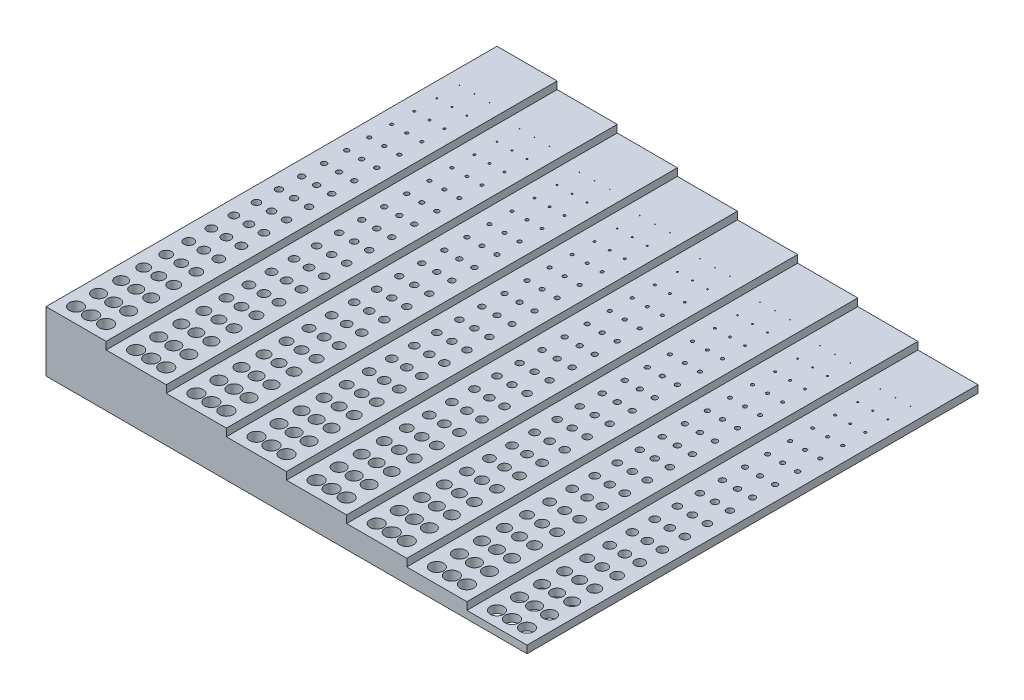
from build123d import *

# Parameters (mm, degrees)
BOSS_EXTRUDE1_DEPTH = 30
CUT_EXTRUDE1_REACH  = 46.045
SKETCH4_R           = 0.45
SKETCH4_R_2         = 0.425
SKETCH4_R_3         = 0.4
SKETCH4_R_4         = 0.375
SKETCH4_R_5         = 0.35
SKETCH4_R_6         = 0.325
SKETCH4_R_7         = 0.3
SKETCH4_R_8         = 0.275
SKETCH4_R_9         = 0.25
SKETCH4_R_10        = 0.225
SKETCH4_R_11        = 0.2
SKETCH4_R_12        = 0.175
SKETCH4_R_13        = 0.15
SKETCH4_R_14        = 0.125
SKETCH4_R_15        = 0.1
SKETCH4_R_16        = 0.075
SKETCH4_R_17        = 0.05
SKETCH4_R_18        = 0.025
LPATTERN1_COUNT     = 31
LPATTERN1_PITCH     = 1


with BuildPart() as part:
    # Sketch3 → Boss-Extrude1 (new body)
    with BuildSketch(Plane.XY):
        Polygon((0, 0), (0, 4), (4, 4), (4, 3.5), (8, 3.5), (8, 3), (12, 3), (12, 2.5), (16, 2.5), (16, 2), (20, 2), (20, 1.5), (24, 1.5), (24, 1), (28, 1), (28, 0.5), (32, 0.5), (32, 0), align=None)
    extrude(amount=BOSS_EXTRUDE1_DEPTH)

    # Sketch4 → Cut-Extrude1 (cut, up to next)
    with BuildSketch(Plane(origin=(0, 4, 0), x_dir=(1, 0, 0), z_dir=(0, 1, 0)), mode=Mode.PRIVATE) as cut_extrude1_sk1:
        with Locations(Location((1, -29, 0), (0, 0, 270))):
            Circle(SKETCH4_R)
    cut_extrude1_tool1 = extrude(cut_extrude1_sk1.sketch, amount=-CUT_EXTRUDE1_REACH, mode=Mode.PRIVATE) & part.part
    # Sketch4 → Cut-Extrude1 (cut, up to next)
    with BuildSketch(Plane(origin=(0, 4, 0), x_dir=(1, 0, 0), z_dir=(0, 1, 0)), mode=Mode.PRIVATE) as cut_extrude1_sk2:
        with Locations(Location((1, -27.5, 0), (0, 0, 270))):
            Circle(SKETCH4_R_2)
    cut_extrude1_tool2 = extrude(cut_extrude1_sk2.sketch, amount=-CUT_EXTRUDE1_REACH, mode=Mode.PRIVATE) & part.part
    # Sketch4 → Cut-Extrude1 (cut, up to next)
    with BuildSketch(Plane(origin=(0, 4, 0), x_dir=(1, 0, 0), z_dir=(0, 1, 0)), mode=Mode.PRIVATE) as cut_extrude1_sk3:
        with Locations(Location((1, -26, 0), (0, 0, 270))):
            Circle(SKETCH4_R_3)
    cut_extrude1_tool3 = extrude(cut_extrude1_sk3.sketch, amount=-CUT_EXTRUDE1_REACH, mode=Mode.PRIVATE) & part.part
    # Sketch4 → Cut-Extrude1 (cut, up to next)
    with BuildSketch(Plane(origin=(0, 4, 0), x_dir=(1, 0, 0), z_dir=(0, 1, 0)), mode=Mode.PRIVATE) as cut_extrude1_sk4:
        with Locations(Location((1, -24.5, 0), (0, 0, 270))):
            Circle(SKETCH4_R_4)
    cut_extrude1_tool4 = extrude(cut_extrude1_sk4.sketch, amount=-CUT_EXTRUDE1_REACH, mode=Mode.PRIVATE) & part.part
    # Sketch4 → Cut-Extrude1 (cut, up to next)
    with BuildSketch(Plane(origin=(0, 4, 0), x_dir=(1, 0, 0), z_dir=(0, 1, 0)), mode=Mode.PRIVATE) as cut_extrude1_sk5:
        with Locations(Location((1, -23, 0), (0, 0, 270))):
            Circle(SKETCH4_R_5)
    cut_extrude1_tool5 = extrude(cut_extrude1_sk5.sketch, amount=-CUT_EXTRUDE1_REACH, mode=Mode.PRIVATE) & part.part
    # Sketch4 → Cut-Extrude1 (cut, up to next)
    with BuildSketch(Plane(origin=(0, 4, 0), x_dir=(1, 0, 0), z_dir=(0, 1, 0)), mode=Mode.PRIVATE) as cut_extrude1_sk6:
        with Locations(Location((1, -21.5, 0), (0, 0, 270))):
            Circle(SKETCH4_R_6)
    cut_extrude1_tool6 = extrude(cut_extrude1_sk6.sketch, amount=-CUT_EXTRUDE1_REACH, mode=Mode.PRIVATE) & part.part
    # Sketch4 → Cut-Extrude1 (cut, up to next)
    with BuildSketch(Plane(origin=(0, 4, 0), x_dir=(1, 0, 0), z_dir=(0, 1, 0)), mode=Mode.PRIVATE) as cut_extrude1_sk7:
        with Locations(Location((1, -20, 0), (0, 0, 270))):
            Circle(SKETCH4_R_7)
    cut_extrude1_tool7 = extrude(cut_extrude1_sk7.sketch, amount=-CUT_EXTRUDE1_REACH, mode=Mode.PRIVATE) & part.part
    # Sketch4 → Cut-Extrude1 (cut, up to next)
    with BuildSketch(Plane(origin=(0, 4, 0), x_dir=(1, 0, 0), z_dir=(0, 1, 0)), mode=Mode.PRIVATE) as cut_extrude1_sk8:
        with Locations(Location((1, -18.5, 0), (0, 0, 270))):
            Circle(SKETCH4_R_8)
    cut_extrude1_tool8 = extrude(cut_extrude1_sk8.sketch, amount=-CUT_EXTRUDE1_REACH, mode=Mode.PRIVATE) & part.part
    # Sketch4 → Cut-Extrude1 (cut, up to next)
    with BuildSketch(Plane(origin=(0, 4, 0), x_dir=(1, 0, 0), z_dir=(0, 1, 0)), mode=Mode.PRIVATE) as cut_extrude1_sk9:
        with Locations(Location((1, -17, 0), (0, 0, 270))):
            Circle(SKETCH4_R_9)
    cut_extrude1_tool9 = extrude(cut_extrude1_sk9.sketch, amount=-CUT_EXTRUDE1_REACH, mode=Mode.PRIVATE) & part.part
    # Sketch4 → Cut-Extrude1 (cut, up to next)
    with BuildSketch(Plane(origin=(0, 4, 0), x_dir=(1, 0, 0), z_dir=(0, 1, 0)), mode=Mode.PRIVATE) as cut_extrude1_sk10:
        with Locations(Location((1, -15.5, 0), (0, 0, 270))):
            Circle(SKETCH4_R_10)
    cut_extrude1_tool10 = extrude(cut_extrude1_sk10.sketch, amount=-CUT_EXTRUDE1_REACH, mode=Mode.PRIVATE) & part.part
    # Sketch4 → Cut-Extrude1 (cut, up to next)
    with BuildSketch(Plane(origin=(0, 4, 0), x_dir=(1, 0, 0), z_dir=(0, 1, 0)), mode=Mode.PRIVATE) as cut_extrude1_sk11:
        with Locations(Location((1, -14, 0), (0, 0, 270))):
            Circle(SKETCH4_R_11)
    cut_extrude1_tool11 = extrude(cut_extrude1_sk11.sketch, amount=-CUT_EXTRUDE1_REACH, mode=Mode.PRIVATE) & part.part
    # Sketch4 → Cut-Extrude1 (cut, up to next)
    with BuildSketch(Plane(origin=(0, 4, 0), x_dir=(1, 0, 0), z_dir=(0, 1, 0)), mode=Mode.PRIVATE) as cut_extrude1_sk12:
        with Locations(Location((1, -12.5, 0), (0, 0, 270))):
            Circle(SKETCH4_R_12)
    cut_extrude1_tool12 = extrude(cut_extrude1_sk12.sketch, amount=-CUT_EXTRUDE1_REACH, mode=Mode.PRIVATE) & part.part
    # Sketch4 → Cut-Extrude1 (cut, up to next)
    with BuildSketch(Plane(origin=(0, 4, 0), x_dir=(1, 0, 0), z_dir=(0, 1, 0)), mode=Mode.PRIVATE) as cut_extrude1_sk13:
        with Locations(Location((1, -11, 0), (0, 0, 270))):
            Circle(SKETCH4_R_13)
    cut_extrude1_tool13 = extrude(cut_extrude1_sk13.sketch, amount=-CUT_EXTRUDE1_REACH, mode=Mode.PRIVATE) & part.part
    # Sketch4 → Cut-Extrude1 (cut, up to next)
    with BuildSketch(Plane(origin=(0, 4, 0), x_dir=(1, 0, 0), z_dir=(0, 1, 0)), mode=Mode.PRIVATE) as cut_extrude1_sk14:
        with Locations(Location((1, -9.5, 0), (0, 0, 270))):
            Circle(SKETCH4_R_14)
    cut_extrude1_tool14 = extrude(cut_extrude1_sk14.sketch, amount=-CUT_EXTRUDE1_REACH, mode=Mode.PRIVATE) & part.part
    # Sketch4 → Cut-Extrude1 (cut, up to next)
    with BuildSketch(Plane(origin=(0, 4, 0), x_dir=(1, 0, 0), z_dir=(0, 1, 0)), mode=Mode.PRIVATE) as cut_extrude1_sk15:
        with Locations(Location((1, -8, 0), (0, 0, 270))):
            Circle(SKETCH4_R_15)
    cut_extrude1_tool15 = extrude(cut_extrude1_sk15.sketch, amount=-CUT_EXTRUDE1_REACH, mode=Mode.PRIVATE) & part.part
    # Sketch4 → Cut-Extrude1 (cut, up to next)
    with BuildSketch(Plane(origin=(0, 4, 0), x_dir=(1, 0, 0), z_dir=(0, 1, 0)), mode=Mode.PRIVATE) as cut_extrude1_sk16:
        with Locations(Location((1, -6.5, 0), (0, 0, 270))):
            Circle(SKETCH4_R_16)
    cut_extrude1_tool16 = extrude(cut_extrude1_sk16.sketch, amount=-CUT_EXTRUDE1_REACH, mode=Mode.PRIVATE) & part.part
    # Sketch4 → Cut-Extrude1 (cut, up to next)
    with BuildSketch(Plane(origin=(0, 4, 0), x_dir=(1, 0, 0), z_dir=(0, 1, 0)), mode=Mode.PRIVATE) as cut_extrude1_sk17:
        with Locations(Location((1, -5, 0), (0, 0, 270))):
            Circle(SKETCH4_R_17)
    cut_extrude1_tool17 = extrude(cut_extrude1_sk17.sketch, amount=-CUT_EXTRUDE1_REACH, mode=Mode.PRIVATE) & part.part
    # Sketch4 → Cut-Extrude1 (cut, up to next)
    with BuildSketch(Plane(origin=(0, 4, 0), x_dir=(1, 0, 0), z_dir=(0, 1, 0)), mode=Mode.PRIVATE) as cut_extrude1_sk18:
        with Locations(Location((1, -3.5, 0), (0, 0, 270))):
            Circle(SKETCH4_R_18)
    cut_extrude1_tool18 = extrude(cut_extrude1_sk18.sketch, amount=-CUT_EXTRUDE1_REACH, mode=Mode.PRIVATE) & part.part
    cut_extrude1_1 = cut_extrude1_tool1.solids().sort_by_distance((1, 4, 29))[0]
    add(cut_extrude1_1, mode=Mode.SUBTRACT)
    cut_extrude1_2 = cut_extrude1_tool2.solids().sort_by_distance((1, 4, 27.5))[0]
    add(cut_extrude1_2, mode=Mode.SUBTRACT)
    cut_extrude1_3 = cut_extrude1_tool3.solids().sort_by_distance((1, 4, 26))[0]
    add(cut_extrude1_3, mode=Mode.SUBTRACT)
    cut_extrude1_4 = cut_extrude1_tool4.solids().sort_by_distance((1, 4, 24.5))[0]
    add(cut_extrude1_4, mode=Mode.SUBTRACT)
    cut_extrude1_5 = cut_extrude1_tool5.solids().sort_by_distance((1, 4, 23))[0]
    add(cut_extrude1_5, mode=Mode.SUBTRACT)
    cut_extrude1_6 = cut_extrude1_tool6.solids().sort_by_distance((1, 4, 21.5))[0]
    add(cut_extrude1_6, mode=Mode.SUBTRACT)
    cut_extrude1_7 = cut_extrude1_tool7.solids().sort_by_distance((1, 4, 20))[0]
    add(cut_extrude1_7, mode=Mode.SUBTRACT)
    cut_extrude1_8 = cut_extrude1_tool8.solids().sort_by_distance((1, 4, 18.5))[0]
    add(cut_extrude1_8, mode=Mode.SUBTRACT)
    cut_extrude1_9 = cut_extrude1_tool9.solids().sort_by_distance((1, 4, 17))[0]
    add(cut_extrude1_9, mode=Mode.SUBTRACT)
    cut_extrude1_10 = cut_extrude1_tool10.solids().sort_by_distance((1, 4, 15.5))[0]
    add(cut_extrude1_10, mode=Mode.SUBTRACT)
    cut_extrude1_11 = cut_extrude1_tool11.solids().sort_by_distance((1, 4, 14))[0]
    add(cut_extrude1_11, mode=Mode.SUBTRACT)
    cut_extrude1_12 = cut_extrude1_tool12.solids().sort_by_distance((1, 4, 12.5))[0]
    add(cut_extrude1_12, mode=Mode.SUBTRACT)
    cut_extrude1_13 = cut_extrude1_tool13.solids().sort_by_distance((1, 4, 11))[0]
    add(cut_extrude1_13, mode=Mode.SUBTRACT)
    cut_extrude1_14 = cut_extrude1_tool14.solids().sort_by_distance((1, 4, 9.5))[0]
    add(cut_extrude1_14, mode=Mode.SUBTRACT)
    cut_extrude1_15 = cut_extrude1_tool15.solids().sort_by_distance((1, 4, 8))[0]
    add(cut_extrude1_15, mode=Mode.SUBTRACT)
    cut_extrude1_16 = cut_extrude1_tool16.solids().sort_by_distance((1, 4, 6.5))[0]
    add(cut_extrude1_16, mode=Mode.SUBTRACT)
    cut_extrude1_17 = cut_extrude1_tool17.solids().sort_by_distance((1, 4, 5))[0]
    add(cut_extrude1_17, mode=Mode.SUBTRACT)
    cut_extrude1_18 = cut_extrude1_tool18.solids().sort_by_distance((1, 4, 3.5))[0]
    add(cut_extrude1_18, mode=Mode.SUBTRACT)
    cut_extrude1 = cut_extrude1_1 + cut_extrude1_2 + cut_extrude1_3 + cut_extrude1_4 + cut_extrude1_5 + cut_extrude1_6 + cut_extrude1_7 + cut_extrude1_8 + cut_extrude1_9 + cut_extrude1_10 + cut_extrude1_11 + cut_extrude1_12 + cut_extrude1_13 + cut_extrude1_14 + cut_extrude1_15 + cut_extrude1_16 + cut_extrude1_17 + cut_extrude1_18  # Cut-Extrude1 as one shape, for the pattern or mirror that repeats it

    # LPattern1: Cut-Extrude1 ×31, 7 skipped
    with Locations(*[(i * LPATTERN1_PITCH, 0, 0) for i in range(1, LPATTERN1_COUNT) if i not in (3, 7, 11, 15, 19, 23, 27)]):
        add(cut_extrude1, mode=Mode.SUBTRACT)


solid = part.part
